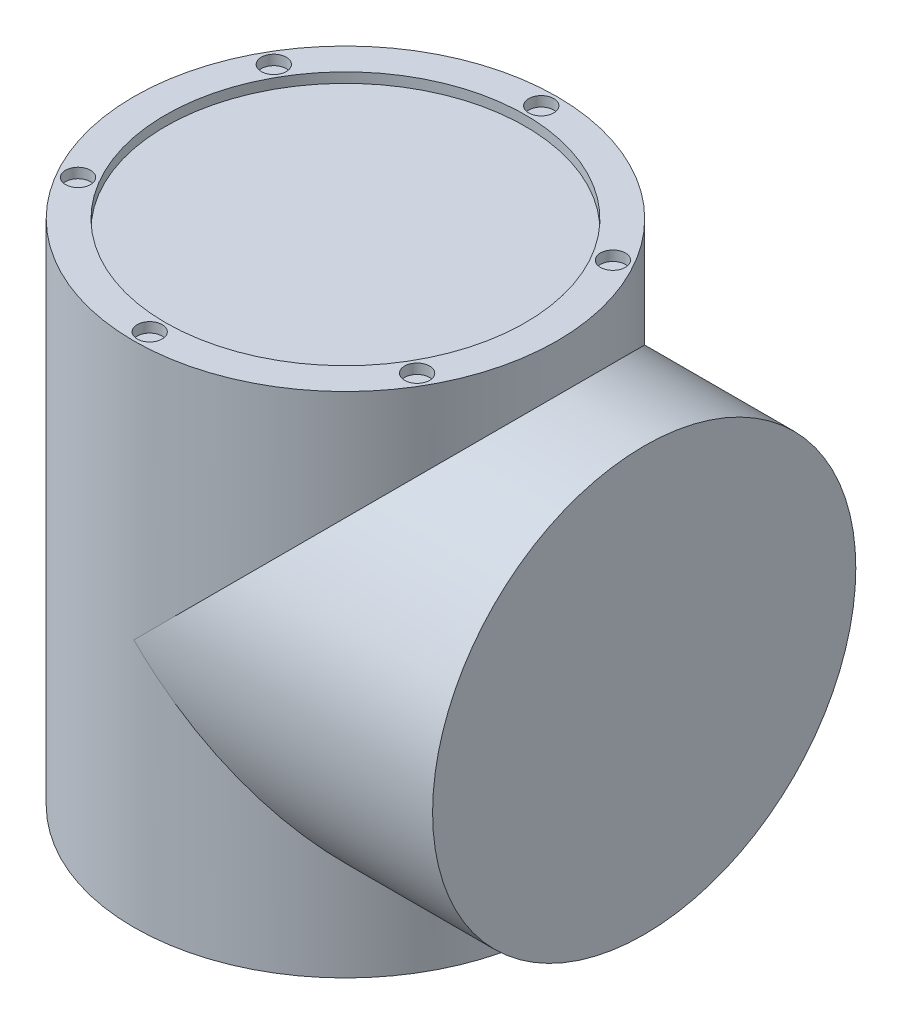
from build123d import *

# Parameters (mm, degrees)
CROQUIS1_R              = 42.5
SALIENTE_EXTRUIR1_DEPTH = 100
CROQUIS2_R              = 42.5
SALIENTE_EXTRUIR2_DEPTH = 60
CROQUIS3_R              = 42.5
CROQUIS3_R_2            = 36.143595246
CROQUIS3_R_3            = 2.508178933
SALIENTE_EXTRUIR3_DEPTH = 2


with BuildPart() as part:
    # Croquis1 → Saliente-Extruir1 (new body)
    with BuildSketch(Plane(origin=(0, 0, 0), x_dir=(1, 0, 0), z_dir=(0, 1, 0))):
        with Locations(Location((0, 0, 0), (0, 0, 270))):
            Circle(CROQUIS1_R)
    extrude(amount=SALIENTE_EXTRUIR1_DEPTH)

    # Croquis2 → Saliente-Extruir2 (add)
    with BuildSketch(Plane(origin=(0, 0, 0), x_dir=(0, 0, -1), z_dir=(1, 0, 0))):
        with Locations((0, 50)):
            Circle(CROQUIS2_R)
    extrude(amount=SALIENTE_EXTRUIR2_DEPTH)

    # Croquis3 → Saliente-Extruir3 (add)
    with BuildSketch(Plane(origin=(0, 100, 0), x_dir=(1, 0, 0), z_dir=(0, 1, 0))):
        with Locations(Location((0, 0, 0), (0, 0, 270))):
            Circle(CROQUIS3_R)
        with Locations(Location((0, 0, 0), (0, 0, 270))):
            Circle(CROQUIS3_R_2, mode=Mode.SUBTRACT)
        with Locations(Location((0, 39.319059372, 0), (0, 0, 270))):
            Circle(CROQUIS3_R_3, mode=Mode.SUBTRACT)
        with Locations(Location((34.051304269, 19.659529686, 0), (0, 0, 270))):
            Circle(CROQUIS3_R_3, mode=Mode.SUBTRACT)
        with Locations(Location((34.051304269, -19.659529686, 0), (0, 0, 270))):
            Circle(CROQUIS3_R_3, mode=Mode.SUBTRACT)
        with Locations(Location((0, -39.319059372, 0), (0, 0, 270))):
            Circle(CROQUIS3_R_3, mode=Mode.SUBTRACT)
        with Locations(Location((-34.051304269, -19.659529686, 0), (0, 0, 270))):
            Circle(CROQUIS3_R_3, mode=Mode.SUBTRACT)
        with Locations(Location((-34.051304269, 19.659529686, 0), (0, 0, 270))):
            Circle(CROQUIS3_R_3, mode=Mode.SUBTRACT)
    extrude(amount=SALIENTE_EXTRUIR3_DEPTH)


solid = part.part
